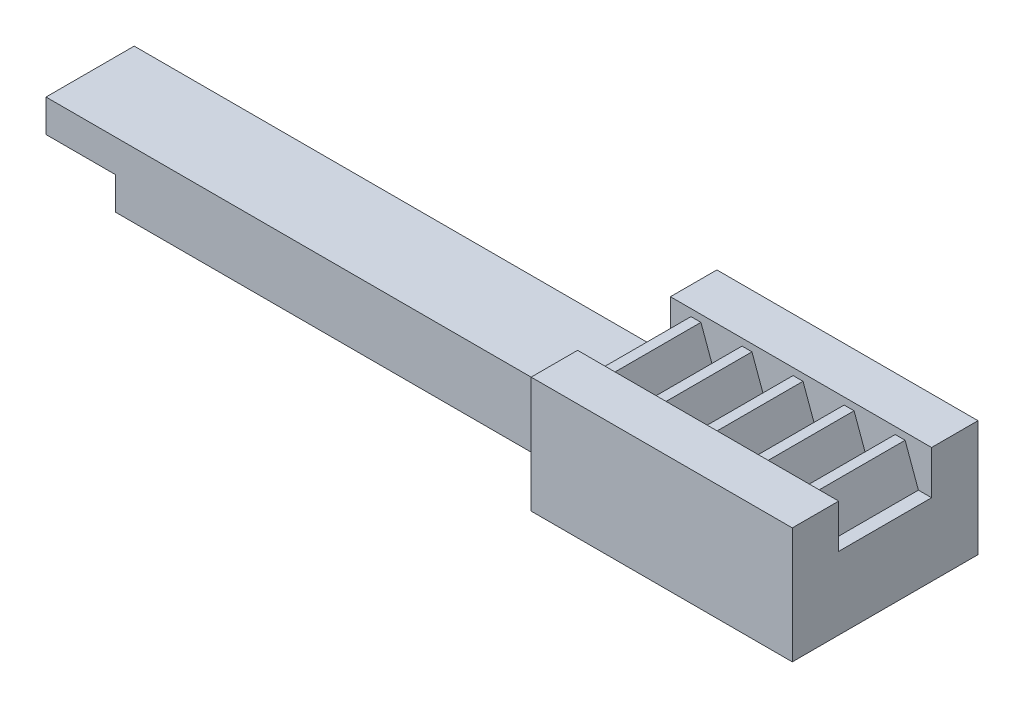
from build123d import *

# Parameters (mm, degrees)
BLANKSKE_W          = 12
BLANKSKE_H          = 4.7
BLANK_DEPTH         = 8
TOOTHCUTSIM_DEPTH   = 16.16871781
TEETHCUTS_COUNT     = 6
TEETHCUTS_PITCH     = 2.199114855
SKETCH1_W           = 12
SKETCH1_H           = 2
BOSS_EXTRUDE1_DEPTH = 5
SKETCH2_W           = 0.75
SKETCH2_H           = 8
CUT_EXTRUDE1_DEPTH  = 5
SKETCH3_W           = 3.8
SKETCH3_H           = 2.8
BOSS_EXTRUDE2_DEPTH = 23
SKETCH4_W           = 3.8
SKETCH4_H           = 1.4
CUT_EXTRUDE2_DEPTH  = 3


with BuildPart() as part:
    # BlankSke → Blank (new body)
    with BuildSketch(Plane.XY):
        with Locations((6, 2.35)):
            Rectangle(BLANKSKE_W, BLANKSKE_H)
    extrude(amount=-BLANK_DEPTH)

    # TooCutSkeSim → ToothCutSim (cut, through all)
    with BuildSketch(Plane.XY):
        Polygon((0.312304759, 3.125), (-0.312304759, 3.125), (-0.894802722, 4.7254), (0.894802722, 4.7254), align=None)
    toothcutsim = extrude(amount=-TOOTHCUTSIM_DEPTH, mode=Mode.SUBTRACT)

    # TeethCuts: ToothCutSim ×6
    with Locations(*[(i * TEETHCUTS_PITCH, 0, 0) for i in range(1, TEETHCUTS_COUNT)]):
        add(toothcutsim, mode=Mode.SUBTRACT)

    # Sketch1 → Boss-Extrude1 (add)
    with BuildSketch(Plane.XZ):
        with Locations((6, -1)):
            Rectangle(SKETCH1_W, SKETCH1_H)
        with Locations((6, -7)):
            Rectangle(SKETCH1_W, SKETCH1_H)
    extrude(amount=-BOSS_EXTRUDE1_DEPTH)

    # Sketch2 → Cut-Extrude1 (cut)
    with BuildSketch(Plane(origin=(0, 0, 0), x_dir=(1, 0, 0), z_dir=(0, 1, 0))):
        with Locations((11.625, 4)):
            Rectangle(SKETCH2_W, SKETCH2_H)
    extrude(amount=CUT_EXTRUDE1_DEPTH, mode=Mode.SUBTRACT)

    # Sketch3 → Boss-Extrude2 (add)
    with BuildSketch(Plane(origin=(0, 0, 0), x_dir=(0, 0, -1), z_dir=(1, 0, 0))):
        with Locations((4, 1.5)):
            Rectangle(SKETCH3_W, SKETCH3_H)
    extrude(amount=-BOSS_EXTRUDE2_DEPTH)

    # Sketch4 → Cut-Extrude2 (cut)
    with BuildSketch(Plane.ZY.offset(23)):
        with Locations((-4, 0.8)):
            Rectangle(SKETCH4_W, SKETCH4_H)
    extrude(amount=-CUT_EXTRUDE2_DEPTH, mode=Mode.SUBTRACT)


solid = part.part
